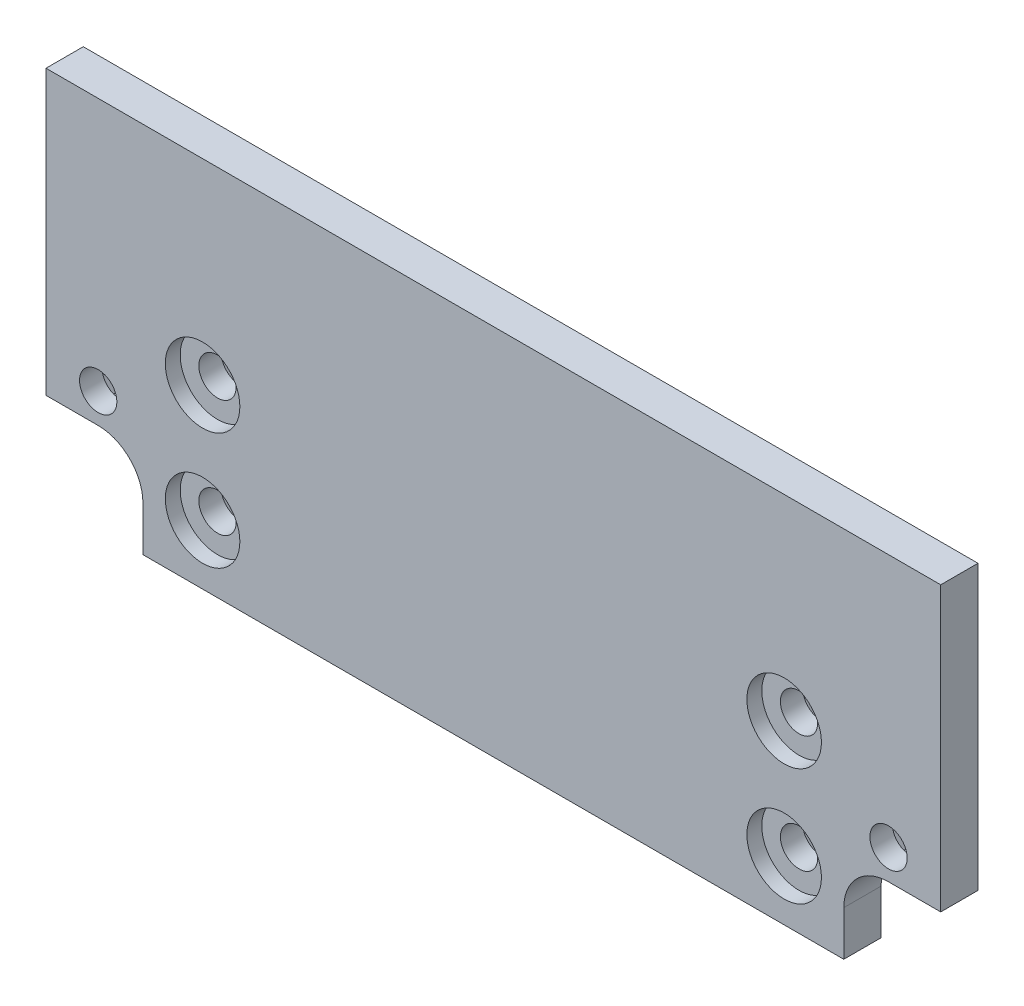
from build123d import *

# Parameters (mm, degrees)
SKETCH_1_W          = 120
SKETCH_1_H          = 50
SKETCH_1_R          = 2.5
EXTRUDE_2_DEPTH     = 5
SKETCH_4_R          = 2.5
CUT_EXTRUDE_1_DEPTH = 66.192024052
SKETCH_7_R          = 5
CUT_EXTRUDE_4_DEPTH = 2
EXTRUDE_3_DEPTH     = 5
SKETCH_11_W         = 5
SKETCH_11_H         = 12
CUT_EXTRUDE_5_DEPTH = 13
FILLET_3_R          = 6
SKETCH_12_W         = 5
SKETCH_12_H         = 12
CUT_EXTRUDE_6_DEPTH = 13
FILLET_4_R          = 6
CUT_EXTRUDE_7_DEPTH = 2


with BuildPart() as part:
    # 草图1 → 凸台-拉伸2 (new body)
    with BuildSketch(Plane.XY):
        Rectangle(SKETCH_1_W, SKETCH_1_H)
        with Locations((-53, -9)):
            Circle(SKETCH_1_R, mode=Mode.SUBTRACT)
        with Locations((53, -9)):
            Circle(SKETCH_1_R, mode=Mode.SUBTRACT)
    extrude(amount=EXTRUDE_2_DEPTH)

    # 草图4 → 切除-拉伸1 (cut, through all)
    with BuildSketch(Plane.XY):
        with Locations((-39, -1.3)):
            Circle(SKETCH_4_R)
        with Locations((-39, -17)):
            Circle(SKETCH_4_R)
        with Locations((39, -1.3)):
            Circle(SKETCH_4_R)
        with Locations((39, -17)):
            Circle(SKETCH_4_R)
    extrude(amount=CUT_EXTRUDE_1_DEPTH, mode=Mode.SUBTRACT)

    # 草图7 → 切除-拉伸4 (cut)
    with BuildSketch(Plane.XY.offset(5)):
        with Locations((-39, -1.3)):
            Circle(SKETCH_7_R)
        with Locations((-39, -17)):
            Circle(SKETCH_7_R)
        with Locations((39, -1.3)):
            Circle(SKETCH_7_R)
        with Locations((39, -17)):
            Circle(SKETCH_7_R)
    extrude(amount=-CUT_EXTRUDE_4_DEPTH, mode=Mode.SUBTRACT)

    # 草图9 → 凸台-拉伸3 (add)
    # profile 1 of 4: a face of its own
    with BuildSketch(Plane(origin=(0, 0, 0), x_dir=(-1, 0, 0), z_dir=(0, 0, -1))):
        Polygon((-34.092522712, -1.3), (-36.546261356, 2.95), (-41.453738644, 2.95), (-43.907477288, -1.3), (-41.453738644, -5.55), (-36.546261356, -5.55), align=None)
        Polygon((-35.24722325, -1.3), (-37.123611625, 1.95), (-40.876388375, 1.95), (-42.75277675, -1.3), (-40.876388375, -4.55), (-37.123611625, -4.55), align=None, mode=Mode.SUBTRACT)
    # profile 2 of 4: a face of its own
    with BuildSketch(Plane(origin=(0, 0, 0), x_dir=(-1, 0, 0), z_dir=(0, 0, -1))):
        Polygon((-34.092522712, -17), (-36.546261356, -12.75), (-41.453738644, -12.75), (-43.907477288, -17), (-41.453738644, -21.25), (-36.546261356, -21.25), align=None)
        Polygon((-35.24722325, -17), (-37.123611625, -13.75), (-40.876388375, -13.75), (-42.75277675, -17), (-40.876388375, -20.25), (-37.123611625, -20.25), align=None, mode=Mode.SUBTRACT)
    # profile 3 of 4: a face of its own
    with BuildSketch(Plane(origin=(0, 0, 0), x_dir=(-1, 0, 0), z_dir=(0, 0, -1))):
        Polygon((43.907477288, -1.3), (41.453738644, 2.95), (36.546261356, 2.95), (34.092522712, -1.3), (36.546261356, -5.55), (41.453738644, -5.55), align=None)
        Polygon((42.75277675, -1.3), (40.876388375, 1.95), (37.123611625, 1.95), (35.24722325, -1.3), (37.123611625, -4.55), (40.876388375, -4.55), align=None, mode=Mode.SUBTRACT)
    # profile 4 of 4: a face of its own
    with BuildSketch(Plane(origin=(0, 0, 0), x_dir=(-1, 0, 0), z_dir=(0, 0, -1))):
        Polygon((43.907477288, -17), (41.453738644, -12.75), (36.546261356, -12.75), (34.092522712, -17), (36.546261356, -21.25), (41.453738644, -21.25), align=None)
        Polygon((42.75277675, -17), (40.876388375, -13.75), (37.123611625, -13.75), (35.24722325, -17), (37.123611625, -20.25), (40.876388375, -20.25), align=None, mode=Mode.SUBTRACT)
    extrude(amount=EXTRUDE_3_DEPTH)

    # 草图11 → 切除-拉伸5 (cut)
    with BuildSketch(Plane(origin=(60, 0, 0), x_dir=(0, 0, -1), z_dir=(1, 0, 0))):
        with Locations((-2.5, -19)):
            Rectangle(SKETCH_11_W, SKETCH_11_H)
    extrude(amount=-CUT_EXTRUDE_5_DEPTH, mode=Mode.SUBTRACT)

    # 圆角3
    fillet_3_edges = [part.edges().sort_by_distance(p)[0] for p in [
        (47, -13, 2.5),
    ]]
    fillet(fillet_3_edges, radius=FILLET_3_R)

    # 草图12 → 切除-拉伸6 (cut)
    with BuildSketch(Plane.ZY.offset(60)):
        with Locations((2.5, -19)):
            Rectangle(SKETCH_12_W, SKETCH_12_H)
    extrude(amount=-CUT_EXTRUDE_6_DEPTH, mode=Mode.SUBTRACT)

    # 圆角4
    fillet_4_edges = [part.edges().sort_by_distance(p)[0] for p in [
        (-47, -13, 2.5),
    ]]
    fillet(fillet_4_edges, radius=FILLET_4_R)

    # 草图13 → 切除-拉伸7 (cut)
    with BuildSketch(Plane(origin=(0, 0, 0), x_dir=(-1, 0, 0), z_dir=(0, 0, -1))):
        Polygon((-49.24722325, -9), (-51.123611625, -5.75), (-54.876388375, -5.75), (-56.75277675, -9), (-54.876388375, -12.25), (-51.123611625, -12.25), align=None)
        Polygon((56.75277675, -9), (54.876388375, -5.75), (51.123611625, -5.75), (49.24722325, -9), (51.123611625, -12.25), (54.876388375, -12.25), align=None)
    extrude(amount=-CUT_EXTRUDE_7_DEPTH, mode=Mode.SUBTRACT)


solid = part.part
